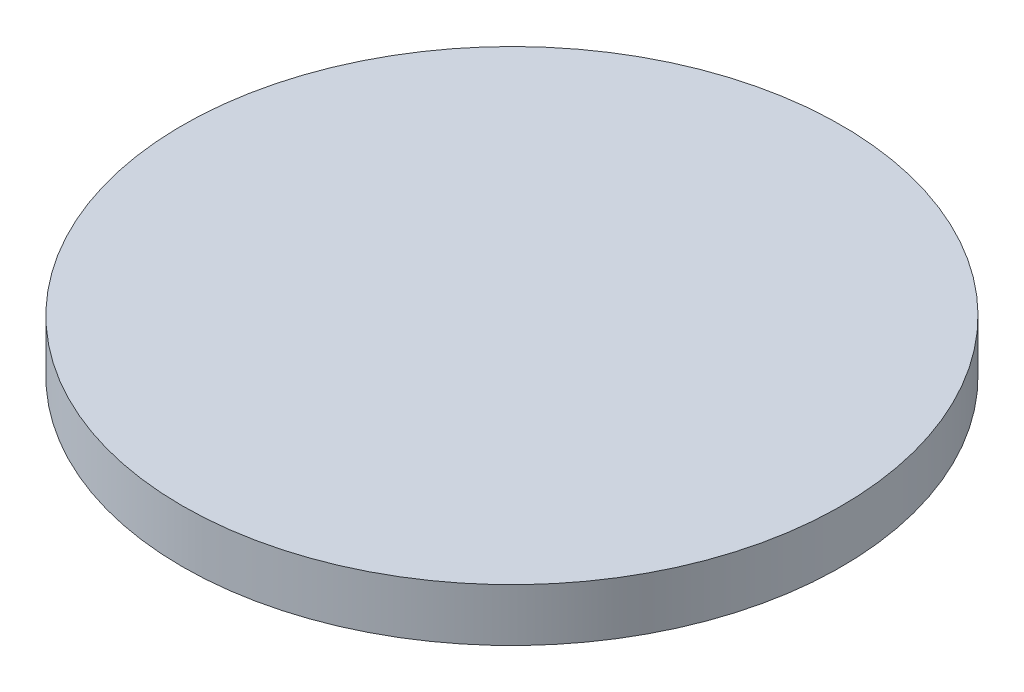
from build123d import *

# Parameters (mm, degrees)
SKETCH1_R           = 25
BOSS_EXTRUDE1_DEPTH = 4
SKETCH2_R           = 4
BOSS_EXTRUDE2_DEPTH = 8


with BuildPart() as part:
    # Sketch1 → Boss-Extrude1 (new body)
    with BuildSketch(Plane(origin=(0, 0, 0), x_dir=(1, 0, 0), z_dir=(0, 1, 0))):
        with Locations(Location((0, 0, 0), (0, 0, 270))):
            Circle(SKETCH1_R)
    extrude(amount=BOSS_EXTRUDE1_DEPTH)

    # Sketch2 → Boss-Extrude2 (add)
    with BuildSketch(Plane.XZ):
        with Locations(Location((0, 0, 0), (0, 0, 270))):
            Circle(SKETCH2_R)
        with BuildLine():
            Line((-2.258317958, 0.95), (-0.95, 0.95))
            Line((-0.95, 0.95), (-0.95, 2.258317958))
            ThreePointArc((-0.95, 2.258317958), (0, 2.45), (0.95, 2.258317958))
            Line((0.95, 2.258317958), (0.95, 0.95))
            Line((0.95, 0.95), (2.258317958, 0.95))
            ThreePointArc((2.258317958, 0.95), (2.45, 0), (2.258317958, -0.95))
            Line((2.258317958, -0.95), (0.95, -0.95))
            Line((0.95, -0.95), (0.95, -2.258317958))
            ThreePointArc((0.95, -2.258317958), (0, -2.45), (-0.95, -2.258317958))
            Line((-0.95, -2.258317958), (-0.95, -0.95))
            Line((-0.95, -0.95), (-2.258317958, -0.95))
            ThreePointArc((-2.258317958, -0.95), (-2.45, 0), (-2.258317958, 0.95))
        make_face(mode=Mode.SUBTRACT)
    extrude(amount=BOSS_EXTRUDE2_DEPTH)


solid = part.part
